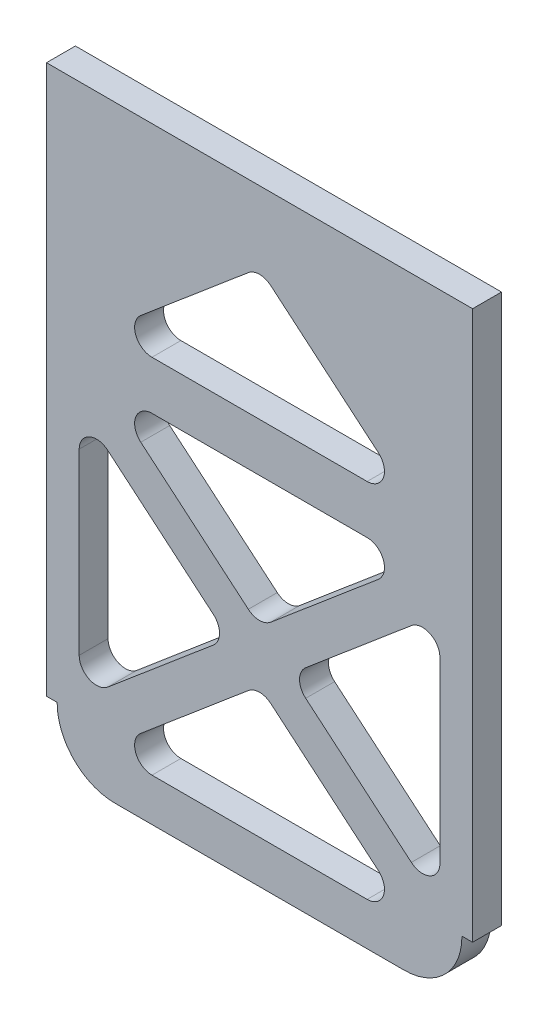
from build123d import *

# Parameters (mm, degrees)
SKETCH1_W           = 73.7
SKETCH1_H           = 105
BOSS_EXTRUDE1_DEPTH = 5
CUT_EXTRUDE1_REACH  = 68.392
CUT_EXTRUDE2_DEPTH  = 67.39218704


with BuildPart() as part:
    # Sketch1 → Boss-Extrude1 (new body)
    with BuildSketch(Plane.XY):
        with Locations((0, 2.5)):
            Rectangle(SKETCH1_W, SKETCH1_H)
    extrude(amount=BOSS_EXTRUDE1_DEPTH)

    # Sketch2 → Cut-Extrude1 (cut, up to next)
    with BuildSketch(Plane(origin=(0, 0, 0), x_dir=(-1, 0, 0), z_dir=(0, 0, -1)), mode=Mode.PRIVATE) as cut_extrude1_sk1:
        with BuildLine():
            Line((-18.606155591, -42.597211127), (18.606155591, -42.597211127))
            ThreePointArc((18.606155591, -42.597211127), (21.423509903, -40.627994657), (20.542210539, -37.30555425))
            Line((20.542210539, -37.30555425), (1.936054948, -21.586560733))
            ThreePointArc((1.936054948, -21.586560733), (0, -20.87821761), (-1.936054948, -21.586560733))
            Line((-1.936054948, -21.586560733), (-20.542210539, -37.30555425))
            ThreePointArc((-20.542210539, -37.30555425), (-21.423509903, -40.627994657), (-18.606155591, -42.597211127))
        make_face()
    cut_extrude1_tool1 = extrude(cut_extrude1_sk1.sketch, amount=-CUT_EXTRUDE1_REACH, mode=Mode.PRIVATE) & part.part
    # Sketch2 → Cut-Extrude1 (cut, up to next)
    with BuildSketch(Plane(origin=(0, 0, 0), x_dir=(-1, 0, 0), z_dir=(0, 0, -1)), mode=Mode.PRIVATE) as cut_extrude1_sk2:
        with BuildLine():
            Line((7.981018958, -17.791656877), (26.25814066, -33.232673486))
            ThreePointArc((26.25814066, -33.232673486), (29.457491922, -33.662060972), (31.194195607, -30.94101661))
            Line((31.194195607, -30.94101661), (31.194195607, -0.05898339))
            ThreePointArc((31.194195607, -0.05898339), (29.457491922, 2.662060972), (26.25814066, 2.232673486))
            Line((26.25814066, 2.232673486), (7.981018958, -13.208343123))
            ThreePointArc((7.981018958, -13.208343123), (6.917073906, -15.5), (7.981018958, -17.791656877))
        make_face()
    cut_extrude1_tool2 = extrude(cut_extrude1_sk2.sketch, amount=-CUT_EXTRUDE1_REACH, mode=Mode.PRIVATE) & part.part
    # Sketch2 → Cut-Extrude1 (cut, up to next)
    with BuildSketch(Plane(origin=(0, 0, 0), x_dir=(-1, 0, 0), z_dir=(0, 0, -1)), mode=Mode.PRIVATE) as cut_extrude1_sk3:
        with BuildLine():
            Line((-31.194195607, -0.05898339), (-31.194195607, -30.94101661))
            ThreePointArc((-31.194195607, -30.94101661), (-29.457491922, -33.662060972), (-26.25814066, -33.232673486))
            Line((-26.25814066, -33.232673486), (-7.981018958, -17.791656877))
            ThreePointArc((-7.981018958, -17.791656877), (-6.917073906, -15.5), (-7.981018958, -13.208343123))
            Line((-7.981018958, -13.208343123), (-26.25814066, 2.232673486))
            ThreePointArc((-26.25814066, 2.232673486), (-29.457491922, 2.662060972), (-31.194195607, -0.05898339))
        make_face()
    cut_extrude1_tool3 = extrude(cut_extrude1_sk3.sketch, amount=-CUT_EXTRUDE1_REACH, mode=Mode.PRIVATE) & part.part
    # Sketch2 → Cut-Extrude1 (cut, up to next)
    with BuildSketch(Plane(origin=(0, 0, 0), x_dir=(-1, 0, 0), z_dir=(0, 0, -1)), mode=Mode.PRIVATE) as cut_extrude1_sk4:
        with BuildLine():
            Line((18.606155591, 11.597211127), (-18.606155591, 11.597211127))
            ThreePointArc((-18.606155591, 11.597211127), (-21.423509903, 9.627994657), (-20.542210539, 6.30555425))
            Line((-20.542210539, 6.30555425), (-1.936054948, -9.413439267))
            ThreePointArc((-1.936054948, -9.413439267), (0, -10.12178239), (1.936054948, -9.413439267))
            Line((1.936054948, -9.413439267), (20.542210539, 6.30555425))
            ThreePointArc((20.542210539, 6.30555425), (21.423509903, 9.627994657), (18.606155591, 11.597211127))
        make_face()
    cut_extrude1_tool4 = extrude(cut_extrude1_sk4.sketch, amount=-CUT_EXTRUDE1_REACH, mode=Mode.PRIVATE) & part.part
    # Sketch2 → Cut-Extrude1 (cut, up to next)
    with BuildSketch(Plane(origin=(0, 0, 0), x_dir=(-1, 0, 0), z_dir=(0, 0, -1)), mode=Mode.PRIVATE) as cut_extrude1_sk5:
        with BuildLine():
            Line((18.606155591, 20), (-18.606155591, 20))
            ThreePointArc((-18.606155591, 20), (-21.423509903, 21.96921647), (-20.542210539, 25.291656877))
            Line((-20.542210539, 25.291656877), (-1.936054948, 41.010650393))
            ThreePointArc((-1.936054948, 41.010650393), (0, 41.718993517), (1.936054948, 41.010650393))
            Line((1.936054948, 41.010650393), (20.542210539, 25.291656877))
            ThreePointArc((20.542210539, 25.291656877), (21.423509903, 21.96921647), (18.606155591, 20))
        make_face()
    cut_extrude1_tool5 = extrude(cut_extrude1_sk5.sketch, amount=-CUT_EXTRUDE1_REACH, mode=Mode.PRIVATE) & part.part
    add(cut_extrude1_tool1.solids().sort_by_distance((0, -34.791369, 0))[0], mode=Mode.SUBTRACT)
    add(cut_extrude1_tool2.solids().sort_by_distance((-22.387881, -15.5, 0))[0], mode=Mode.SUBTRACT)
    add(cut_extrude1_tool3.solids().sort_by_distance((22.387881, -15.5, 0))[0], mode=Mode.SUBTRACT)
    add(cut_extrude1_tool4.solids().sort_by_distance((0, 3.791369, 0))[0], mode=Mode.SUBTRACT)
    add(cut_extrude1_tool5.solids().sort_by_distance((0, 27.805842, 0))[0], mode=Mode.SUBTRACT)

    # Sketch7 → Cut-Extrude2 (cut, through all)
    with BuildSketch(Plane.XY.offset(5)):
        with BuildLine():
            Line((-36.85, -39.9), (-36.85, -50))
            Line((-36.85, -50), (-25, -50))
            ThreePointArc((-25, -50), (-32.071067812, -47.071067812), (-35, -40))
            Line((-35, -40), (-35, -39.9))
            Line((-35, -39.9), (-36.85, -39.9))
        make_face()
        with BuildLine():
            ThreePointArc((35, -40), (32.071067812, -47.071067812), (25, -50))
            Line((25, -50), (36.85, -50))
            Line((36.85, -50), (36.85, -39.9))
            Line((36.85, -39.9), (35, -39.9))
            Line((35, -39.9), (35, -40))
        make_face()
    extrude(amount=-CUT_EXTRUDE2_DEPTH, mode=Mode.SUBTRACT)


solid = part.part
